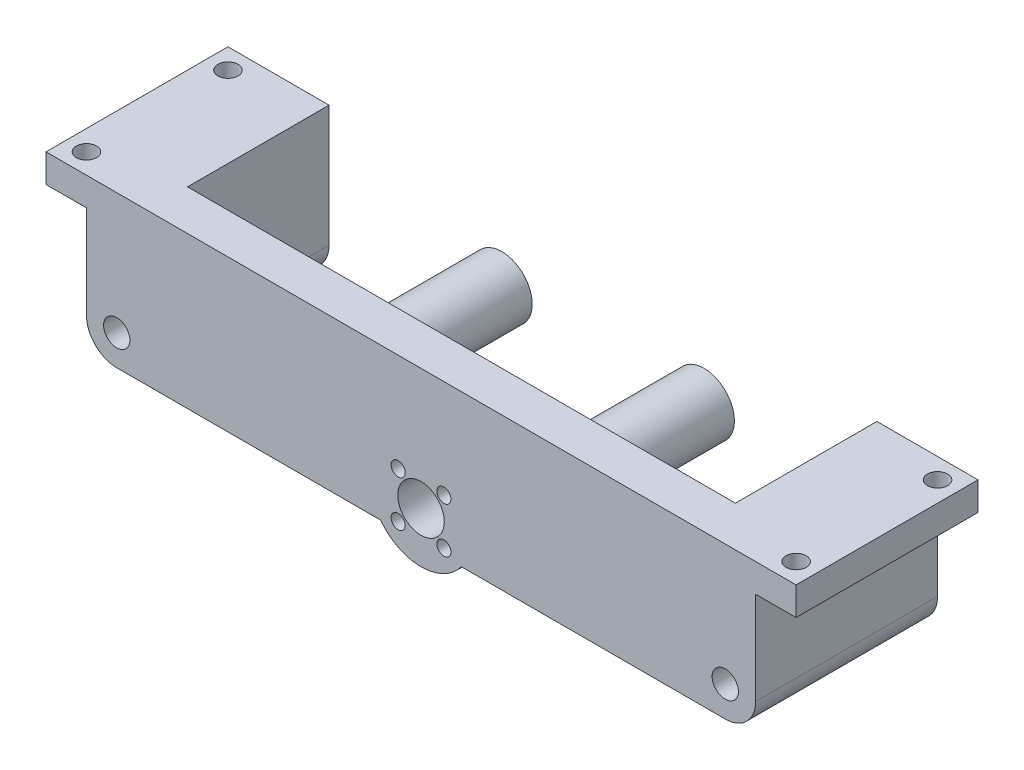
from build123d import *
from build123d.topology import SkipClean

# Parameters (mm, degrees)
SKETCH1_R           = 12.5
SKETCH1_R_2         = 1.75
SKETCH1_R_3         = 5.75
SKETCH1_R_4         = 7.5
SKETCH1_R_5         = 3.25
SKETCH1_W           = 10
SKETCH1_H           = 7
BOSS_EXTRUDE1_DEPTH = 10
BOSS_EXTRUDE2_START = 35
SKETCH2_R           = 3.25
SKETCH2_R_2         = 7.5
BOSS_EXTRUDE2_DEPTH = 35
SKETCH3_R           = 2.5
CUT_EXTRUDE1_DEPTH  = 35


with BuildPart() as part:
    # Sketch1 → Boss-Extrude1 (new body)
    # profile 1 of 8: a face of its own
    with BuildSketch(Plane.XY):
        with BuildLine():
            Line((-12.5, 30), (-12.5, 0))
            ThreePointArc((-12.5, 0), (0, 12.5), (12.5, 0))
            Line((12.5, 0), (12.5, 30))
            Line((12.5, 30), (-12.5, 30))
        make_face()
    # profile 2 of 8: a face of its own
    with BuildSketch(Plane.XY):
        Circle(SKETCH1_R)
        with Locations((-5.656854249, -5.656854249)):
            Circle(SKETCH1_R_2, mode=Mode.SUBTRACT)
        with Locations((5.656854249, -5.656854249)):
            Circle(SKETCH1_R_2, mode=Mode.SUBTRACT)
        with Locations((5.656854249, 5.656854249)):
            Circle(SKETCH1_R_2, mode=Mode.SUBTRACT)
        with Locations((-5.656854249, 5.656854249)):
            Circle(SKETCH1_R_2, mode=Mode.SUBTRACT)
        Circle(SKETCH1_R_3, mode=Mode.SUBTRACT)
    # profile 3 of 8: a face of its own
    with BuildSketch(Plane.XY):
        with Locations((-75.25, 0)):
            Circle(SKETCH1_R_4)
        with Locations((-75.25, 0)):
            Circle(SKETCH1_R_5, mode=Mode.SUBTRACT)
    # profile 4 of 8: a face of its own
    with BuildSketch(Plane.XY):
        with Locations((75.25, 0)):
            Circle(SKETCH1_R_4)
        with Locations((75.25, 0)):
            Circle(SKETCH1_R_5, mode=Mode.SUBTRACT)
    # profile 5 of 8: a face of its own
    with BuildSketch(Plane.XY):
        with BuildLine():
            Line((12.5, 30), (12.5, 0))
            ThreePointArc((12.5, 0), (11.858541226, -3.952847075), (10, -7.5))
            Line((10, -7.5), (75.25, -7.5))
            ThreePointArc((75.25, -7.5), (69.946699141, 5.303300859), (82.75, 0))
            Line((82.75, 0), (82.75, 23))
            Line((82.75, 23), (82.75, 30))
            Line((82.75, 30), (12.5, 30))
        make_face()
    # profile 6 of 8: a face of its own
    with BuildSketch(Plane.XY):
        with BuildLine():
            ThreePointArc((-10, -7.5), (-11.858541226, -3.952847075), (-12.5, 0))
            Line((-12.5, 0), (-12.5, 30))
            Line((-12.5, 30), (-82.75, 30))
            Line((-82.75, 30), (-82.75, 23))
            Line((-82.75, 23), (-82.75, 0))
            ThreePointArc((-82.75, 0), (-75.25, 7.5), (-67.75, 0))
            ThreePointArc((-67.75, 0), (-69.946699141, -5.303300859), (-75.25, -7.5))
            Line((-75.25, -7.5), (-10, -7.5))
        make_face()
    # profile 7 of 8: a face of its own
    with BuildSketch(Plane.XY):
        with Locations((-87.75, 26.5)):
            Rectangle(SKETCH1_W, SKETCH1_H)
    # profile 8 of 8: a face of its own
    with BuildSketch(Plane.XY):
        with Locations((87.75, 26.5)):
            Rectangle(SKETCH1_W, SKETCH1_H)
    extrude(amount=BOSS_EXTRUDE1_DEPTH)

    # Sketch2 → Boss-Extrude2 (add)
    # profile 1 of 4: a face of its own
    with SkipClean():  # the faces are left unmerged after this step: merging them gives an invalid solid
        with BuildSketch(Plane(origin=(0, 0, 0), x_dir=(-1, 0, 0), z_dir=(0, 0, -1)).offset(BOSS_EXTRUDE2_START)):
            with BuildLine():
                Line((-82.75, 23), (-82.75, 0))
                ThreePointArc((-82.75, 0), (-75.25, -7.5), (-67.75, 0))
                Line((-67.75, 0), (-67.75, 30))
                Line((-67.75, 30), (-92.75, 30))
                Line((-92.75, 30), (-92.75, 23))
                Line((-92.75, 23), (-82.75, 23))
            make_face()
            with Locations((-75.25, 0)):
                Circle(SKETCH2_R, mode=Mode.SUBTRACT)
        # profile 2 of 4: a face of its own
        with BuildSketch(Plane(origin=(0, 0, 0), x_dir=(-1, 0, 0), z_dir=(0, 0, -1)).offset(BOSS_EXTRUDE2_START)):
            with BuildLine():
                Line((92.75, 30), (67.75, 30))
                Line((67.75, 30), (67.75, 0))
                ThreePointArc((67.75, 0), (75.25, -7.5), (82.75, 0))
                Line((82.75, 0), (82.75, 23))
                Line((82.75, 23), (92.75, 23))
                Line((92.75, 23), (92.75, 30))
            make_face()
            with Locations((75.25, 0)):
                Circle(SKETCH2_R, mode=Mode.SUBTRACT)
        # profile 3 of 4: a face of its own
        with BuildSketch(Plane(origin=(0, 0, 0), x_dir=(-1, 0, 0), z_dir=(0, 0, -1)).offset(BOSS_EXTRUDE2_START)):
            with Locations(Location((-25, 12.5, 0), (0, 0, 180))):
                Circle(SKETCH2_R_2)
        # profile 4 of 4: a face of its own
        with BuildSketch(Plane(origin=(0, 0, 0), x_dir=(-1, 0, 0), z_dir=(0, 0, -1)).offset(BOSS_EXTRUDE2_START)):
            with Locations(Location((25, 12.5, 0), (0, 0, 180))):
                Circle(SKETCH2_R_2)
        extrude(amount=-BOSS_EXTRUDE2_DEPTH)

    # Sketch3 → Cut-Extrude1 (cut)
    with SkipClean():  # the faces are left unmerged after this step: merging them gives an invalid solid
        with BuildSketch(Plane(origin=(0, 30, 0), x_dir=(1, 0, 0), z_dir=(0, 1, 0))):
            with Locations(Location((-87.75, 30, 0), (0, 0, 180))):
                Circle(SKETCH3_R)
            with Locations(Location((-87.75, -5, 0), (0, 0, 180))):
                Circle(SKETCH3_R)
            with Locations(Location((87.75, 30, 0), (0, 0, 180))):
                Circle(SKETCH3_R)
            with Locations(Location((87.75, -5, 0), (0, 0, 180))):
                Circle(SKETCH3_R)
        extrude(amount=-CUT_EXTRUDE1_DEPTH, mode=Mode.SUBTRACT)


solid = part.part
